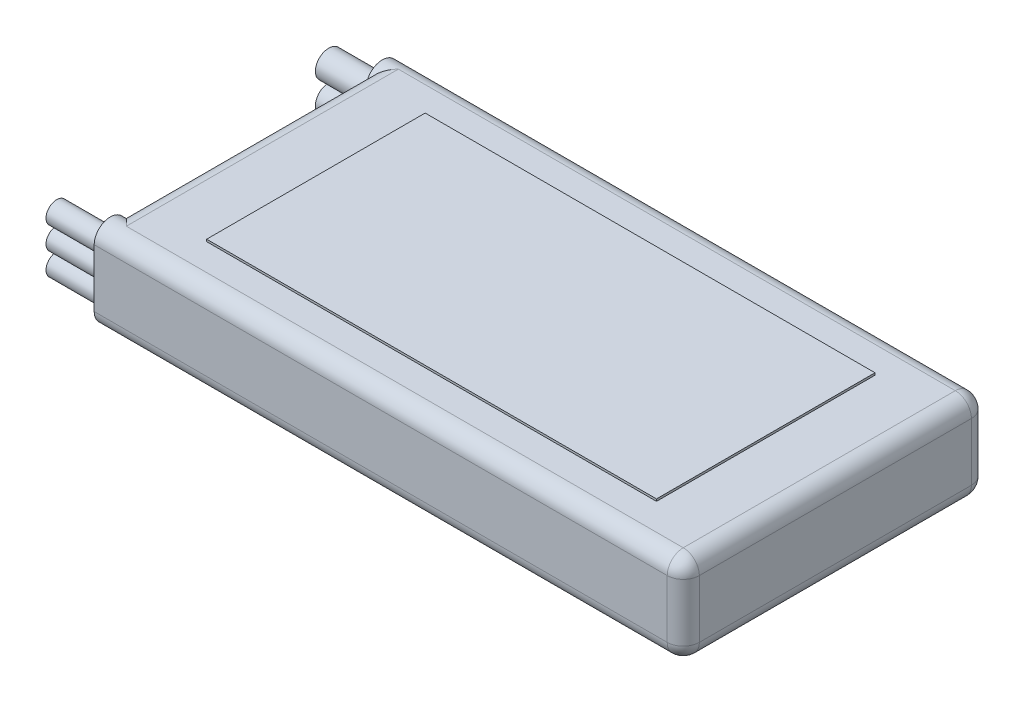
from build123d import *

# Parameters (mm, degrees)
SKETCH1_W       = 69.85
SKETCH1_H       = 36.068
BATTERY_DEPTH   = 10.668
FILLET_2_R      = 1.905
WIRE_BOSS_DEPTH = 5.08
SKETCH3_R       = 1.27
SKETCH3_R_2     = 1.5875
WIRES_2_DEPTH   = 6.35
SKETCH4_W       = 53.34
SKETCH4_H       = 25.908
LABEL_DEPTH     = 0.254


with BuildPart() as part:
    # Sketch1 → Battery (new body)
    with BuildSketch(Plane(origin=(0, 0, 0), x_dir=(1, 0, 0), z_dir=(0, 1, 0))):
        with Locations((8.399917755, 5.125761329)):
            Rectangle(SKETCH1_W, SKETCH1_H)
    extrude(amount=BATTERY_DEPTH)

    # Fillet 2
    fillet_2_edges = [part.edges().sort_by_distance(p)[0] for p in [
        (43.324917755, 10.668, -5.125761329),
        (8.399917755, 10.668, -23.159761329),
        (-26.525082245, 10.668, -5.125761329),
        (8.399917755, 0, -23.159761329),
        (43.324917755, 0, -5.125761329),
        (8.399917755, 0, 12.908238671),
        (-26.525082245, 0, -5.125761329),
        (8.399917755, 10.668, 12.908238671),
        (-26.525082245, 5.334, -23.159761329),
        (43.324917755, 5.334, -23.159761329),
        (43.324917755, 5.334, 12.908238671),
        (-26.525082245, 5.334, 12.908238671),
    ]]
    fillet(fillet_2_edges, radius=FILLET_2_R)

    # Sketch2 → Wire Boss (add)
    with BuildSketch(Plane.ZY.offset(26.525082245)):
        with BuildLine():
            Line((12.908238671, 8.763), (12.908238671, 1.905))
            ThreePointArc((12.908238671, 1.905), (11.003238671, 0), (9.098238671, 1.905))
            Line((9.098238671, 1.905), (9.098238671, 8.763))
            ThreePointArc((9.098238671, 8.763), (11.003238671, 10.668), (12.908238671, 8.763))
        make_face()
        with BuildLine():
            Line((-19.349761329, 8.763), (-19.349761329, 1.905))
            ThreePointArc((-19.349761329, 1.905), (-21.254761329, 0), (-23.159761329, 1.905))
            Line((-23.159761329, 1.905), (-23.159761329, 8.763))
            ThreePointArc((-23.159761329, 8.763), (-21.254761329, 10.668), (-19.349761329, 8.763))
        make_face()
    extrude(amount=-WIRE_BOSS_DEPTH)

    # Sketch3 → Wires 2 (add)
    with BuildSketch(Plane.ZY.offset(26.525082245)):
        with Locations(Location((11.003238671, 8.001, 0), (0, 0, 180))):
            Circle(SKETCH3_R)
        with Locations(Location((11.003238671, 5.334, 0), (0, 0, 180))):
            Circle(SKETCH3_R)
        with Locations(Location((11.003238671, 2.667, 0), (0, 0, 180))):
            Circle(SKETCH3_R)
        with Locations(Location((-21.254761329, 7.112, 0), (0, 0, 180))):
            Circle(SKETCH3_R_2)
        with Locations(Location((-21.254761329, 3.556, 0), (0, 0, 180))):
            Circle(SKETCH3_R_2)
    extrude(amount=WIRES_2_DEPTH)

    # Sketch4 → Label (add)
    with BuildSketch(Plane(origin=(0, 10.668, 0), x_dir=(1, 0, 0), z_dir=(0, 1, 0))):
        with Locations((8.399917755, 5.125761329)):
            Rectangle(SKETCH4_W, SKETCH4_H)
    extrude(amount=LABEL_DEPTH)


solid = part.part
